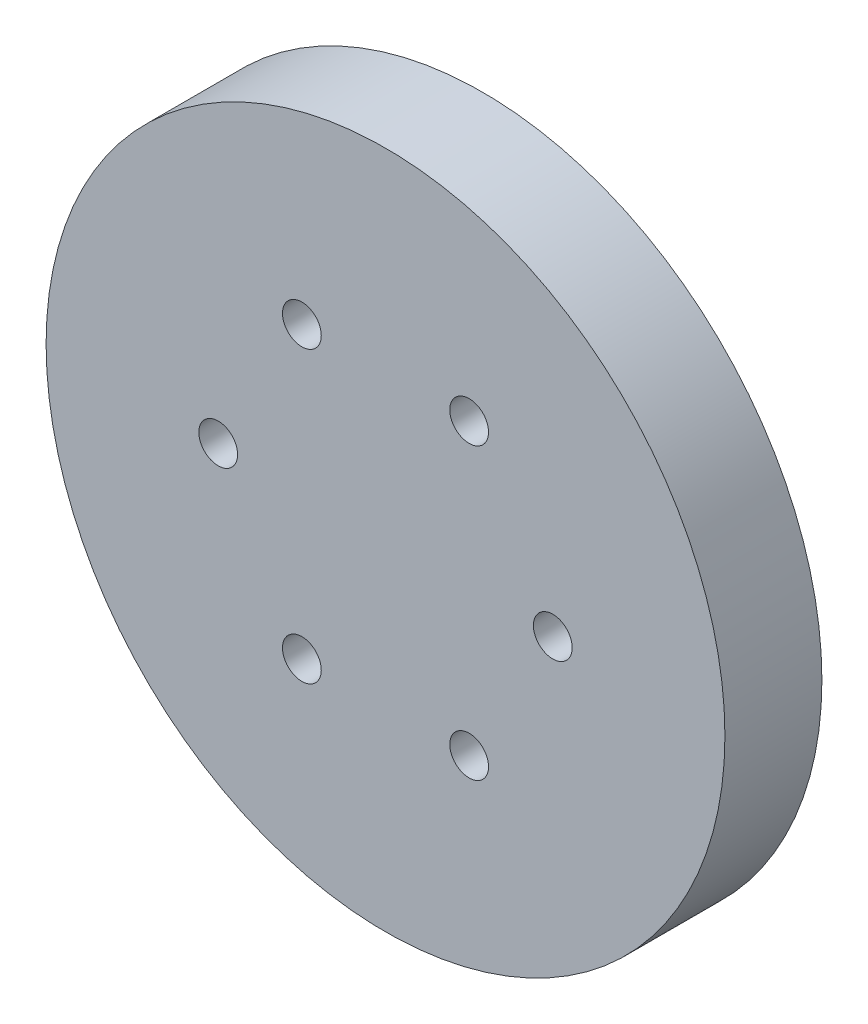
from build123d import *

# Parameters (mm, degrees)
SKETCH_1_R      = 35
SKETCH_1_R_2    = 2
EXTRUDE_1_DEPTH = 10


with BuildPart() as part:
    # 草图1 → 凸台-拉伸1 (new body)
    with BuildSketch(Plane.XY):
        Circle(SKETCH_1_R)
        with Locations((-17.25, 0)):
            Circle(SKETCH_1_R_2, mode=Mode.SUBTRACT)
        with Locations((-8.625, 14.938938215)):
            Circle(SKETCH_1_R_2, mode=Mode.SUBTRACT)
        with Locations((8.625, 14.938938215)):
            Circle(SKETCH_1_R_2, mode=Mode.SUBTRACT)
        with Locations((17.25, 0)):
            Circle(SKETCH_1_R_2, mode=Mode.SUBTRACT)
        with Locations((8.625, -14.938938215)):
            Circle(SKETCH_1_R_2, mode=Mode.SUBTRACT)
        with Locations((-8.625, -14.938938215)):
            Circle(SKETCH_1_R_2, mode=Mode.SUBTRACT)
    extrude(amount=EXTRUDE_1_DEPTH)


solid = part.part
